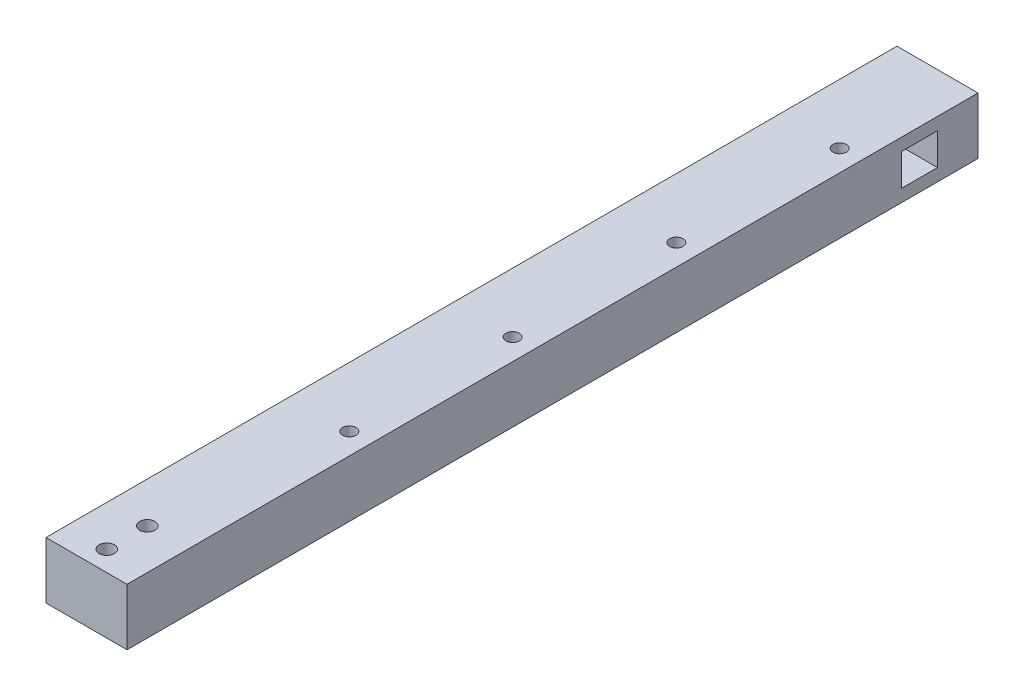
from build123d import *

# Parameters (mm, degrees)
SKETCH1_W               = 12.7
SKETCH1_H               = 133.35
BOSS_EXTRUDE1_DEPTH     = 4.445
CUT_EXTRUDE1_DEPTH      = 68.564119361
CUT_EXTRUDE1_DEPTH_BACK = 68.564119361
SKETCH2_R               = 1.2
SKETCH3_R               = 1.2
CUT_EXTRUDE2_DEPTH      = 12
SKETCH4_W               = 5.65
SKETCH4_H               = 5
CUT_EXTRUDE3_DEPTH      = 69.019141791
SKETCH5_R               = 1.054294776
CUT_EXTRUDE4_DEPTH      = 68.564119361


with BuildPart() as part:
    # Sketch1 → Boss-Extrude1 (new, symmetric)
    with BuildSketch(Plane(origin=(0, 0, 0), x_dir=(1, 0, 0), z_dir=(0, 1, 0))):
        Rectangle(SKETCH1_W, SKETCH1_H)
    extrude(amount=BOSS_EXTRUDE1_DEPTH, both=True)

    # Sketch2 → Cut-Extrude1 (cut, two sides: drawn at the far end of the back side and taken through both)
    with BuildSketch(Plane.XZ.offset(4.445).offset(-CUT_EXTRUDE1_DEPTH_BACK)):
        with Locations(Location((0, 57.15, 0), (0, 0, 270))):
            Circle(SKETCH2_R)
        with Locations(Location((0, 63.5, 0), (0, 0, 270))):
            Circle(SKETCH2_R)
    extrude(amount=CUT_EXTRUDE1_DEPTH + CUT_EXTRUDE1_DEPTH_BACK, mode=Mode.SUBTRACT)

    # Sketch3 → Cut-Extrude2 (cut)
    with BuildSketch(Plane(origin=(0, 0, -66.675), x_dir=(-1, 0, 0), z_dir=(0, 0, -1))):
        Circle(SKETCH3_R)
    extrude(amount=-CUT_EXTRUDE2_DEPTH, mode=Mode.SUBTRACT)

    # Sketch4 → Cut-Extrude3 (cut, through all)
    with BuildSketch(Plane(origin=(6.35, 0, 0), x_dir=(0, 0, -1), z_dir=(1, 0, 0))):
        with Locations((57.5, 0)):
            Rectangle(SKETCH4_W, SKETCH4_H)
    extrude(amount=-CUT_EXTRUDE3_DEPTH, mode=Mode.SUBTRACT)

    # Sketch5 → Cut-Extrude4 (cut, through all)
    with BuildSketch(Plane.XZ.offset(4.445)):
        with Locations(Location((3.015690418, -48.331496192, 0), (0, 0, 270))):
            Circle(SKETCH5_R)
        with Locations(Location((3.015690418, -22.739006486, 0), (0, 0, 270))):
            Circle(SKETCH5_R)
        with Locations(Location((3.015690418, 2.918503808, 0), (0, 0, 270))):
            Circle(SKETCH5_R)
        with Locations(Location((3.015690418, 28.510993514, 0), (0, 0, 270))):
            Circle(SKETCH5_R)
    extrude(amount=-CUT_EXTRUDE4_DEPTH, mode=Mode.SUBTRACT)


solid = part.part
